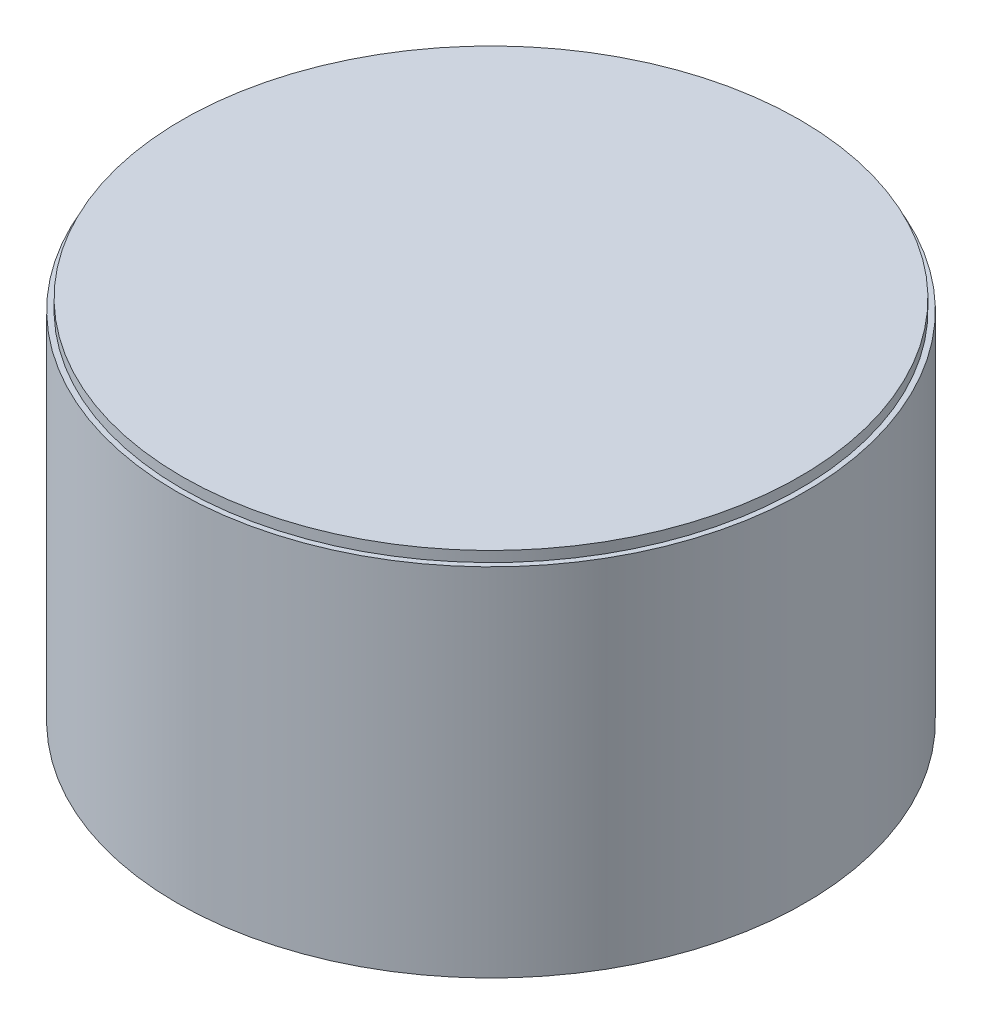
from build123d import *

# Parameters (mm, degrees)
SKETCH1_R           = 3
BOSS_EXTRUDE1_DEPTH = 1.7
SKETCH2_R           = 2.95
BOSS_EXTRUDE2_DEPTH = 0.1


with BuildPart() as part:
    # Sketch1 → Boss-Extrude1 (new, symmetric)
    with BuildSketch(Plane(origin=(0, 0, 0), x_dir=(1, 0, 0), z_dir=(0, 1, 0))):
        with Locations(Location((0, 0, 0), (0, 0, 270))):
            Circle(SKETCH1_R)
    extrude(amount=BOSS_EXTRUDE1_DEPTH, both=True)

    # Sketch2 → Boss-Extrude2 (add)
    with BuildSketch(Plane(origin=(0, 1.7, 0), x_dir=(1, 0, 0), z_dir=(0, 1, 0))):
        with Locations(Location((0, 0, 0), (0, 0, 270))):
            Circle(SKETCH2_R)
    extrude(amount=BOSS_EXTRUDE2_DEPTH)


solid = part.part
